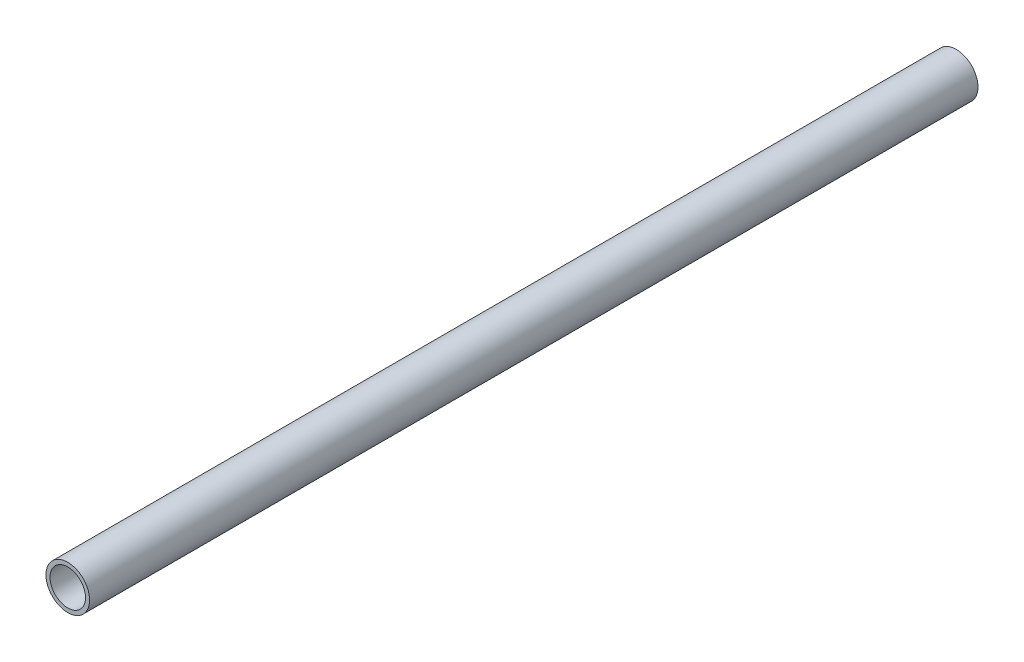
from build123d import *

# Parameters (mm, degrees)
CROQUIS1_R              = 8.1
CROQUIS1_R_2            = 6.6
SALIENTE_EXTRUIR1_DEPTH = 165


with BuildPart() as part:
    # Croquis1 → Saliente-Extruir1 (new, symmetric)
    with BuildSketch(Plane.XY):
        Circle(CROQUIS1_R)
        Circle(CROQUIS1_R_2, mode=Mode.SUBTRACT)
    extrude(amount=SALIENTE_EXTRUIR1_DEPTH, both=True)


solid = part.part
